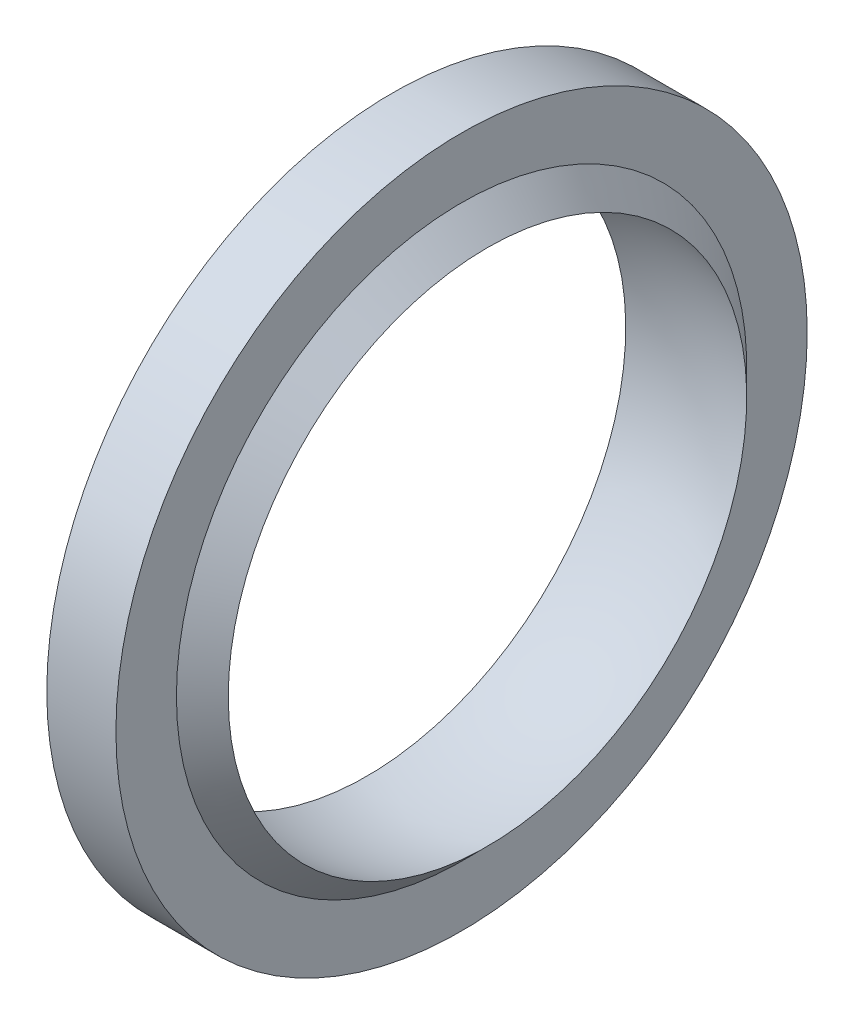
from build123d import *


with BuildPart() as part:
    # Esquisse1 → Base-Révolution (revolve)
    with BuildSketch(Plane.XY, mode=Mode.PRIVATE) as base_r_volution_sk:
        with BuildLine():
            Line((-2, 20), (2, 20))
            Line((2, 20), (2, 16.5))
            Line((2, 16.5), (3.5, 15))
            ThreePointArc((3.5, 15), (0, 15.402921801), (-3.5, 15))
            Line((-3.5, 15), (-2, 16.5))
            Line((-2, 16.5), (-2, 20))
        make_face()
    revolve(base_r_volution_sk.sketch.rotate(Axis((0, 0, 0), (1, 0, 0)), 90), axis=Axis((0, 0, 0), (1, 0, 0)))


solid = part.part
